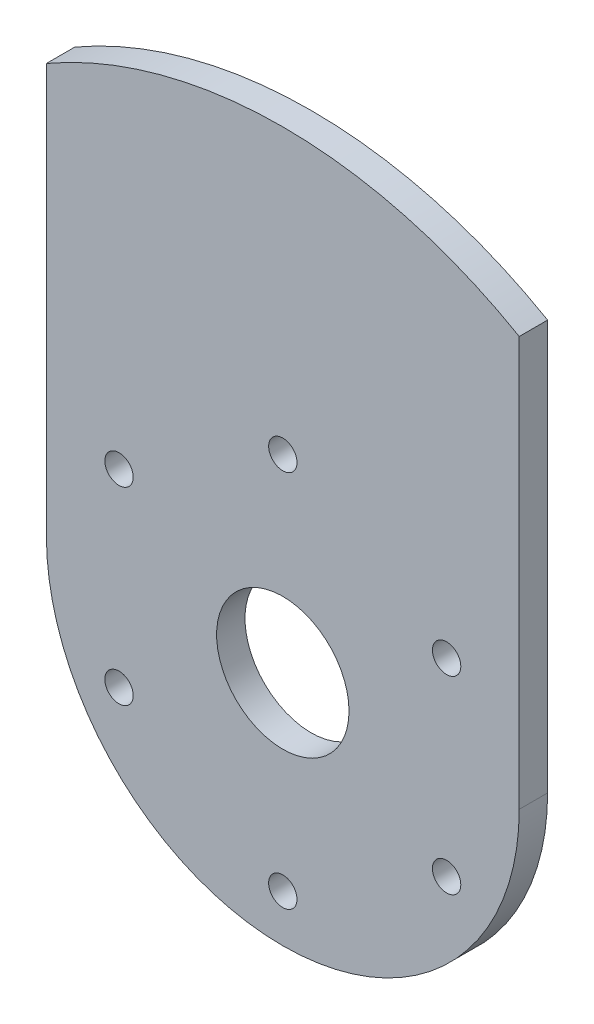
from build123d import *

# Parameters (mm, degrees)
ESQUISSE1_R             = 50
ESQUISSE1_R_2           = 7
BOSS_EXTRU_1_DEPTH      = 3
ESQUISSE2_R             = 1.5
ENL_V_MAT_EXTRU_1_DEPTH = 71.774289117


with BuildPart() as part:
    # Esquisse1 → Boss.-Extru.1 (new body)
    with BuildSketch(Plane.XY):
        Circle(ESQUISSE1_R)
        Circle(ESQUISSE1_R_2, mode=Mode.SUBTRACT)
    extrude(amount=BOSS_EXTRU_1_DEPTH)

    # Esquisse2 → Enlèv. mat.-Extru.1 (cut, through all)
    with BuildSketch(Plane.XY.offset(3)):
        with BuildLine():
            Line((25, 43.301270189), (25, 0))
            ThreePointArc((25, 0), (0, -25), (-25, 0))
            Line((-25, 0), (-25, 43.301270189))
            ThreePointArc((-25, 43.301270189), (0, -50), (25, 43.301270189))
        make_face()
        with Locations((0, 20)):
            Circle(ESQUISSE2_R)
        with Locations((17.320508076, 10)):
            Circle(ESQUISSE2_R)
        with Locations((17.320508076, -10)):
            Circle(ESQUISSE2_R)
        with Locations((0, -20)):
            Circle(ESQUISSE2_R)
        with Locations((-17.320508076, -10)):
            Circle(ESQUISSE2_R)
        with Locations((-17.320508076, 10)):
            Circle(ESQUISSE2_R)
    extrude(amount=-ENL_V_MAT_EXTRU_1_DEPTH, mode=Mode.SUBTRACT)


solid = part.part
